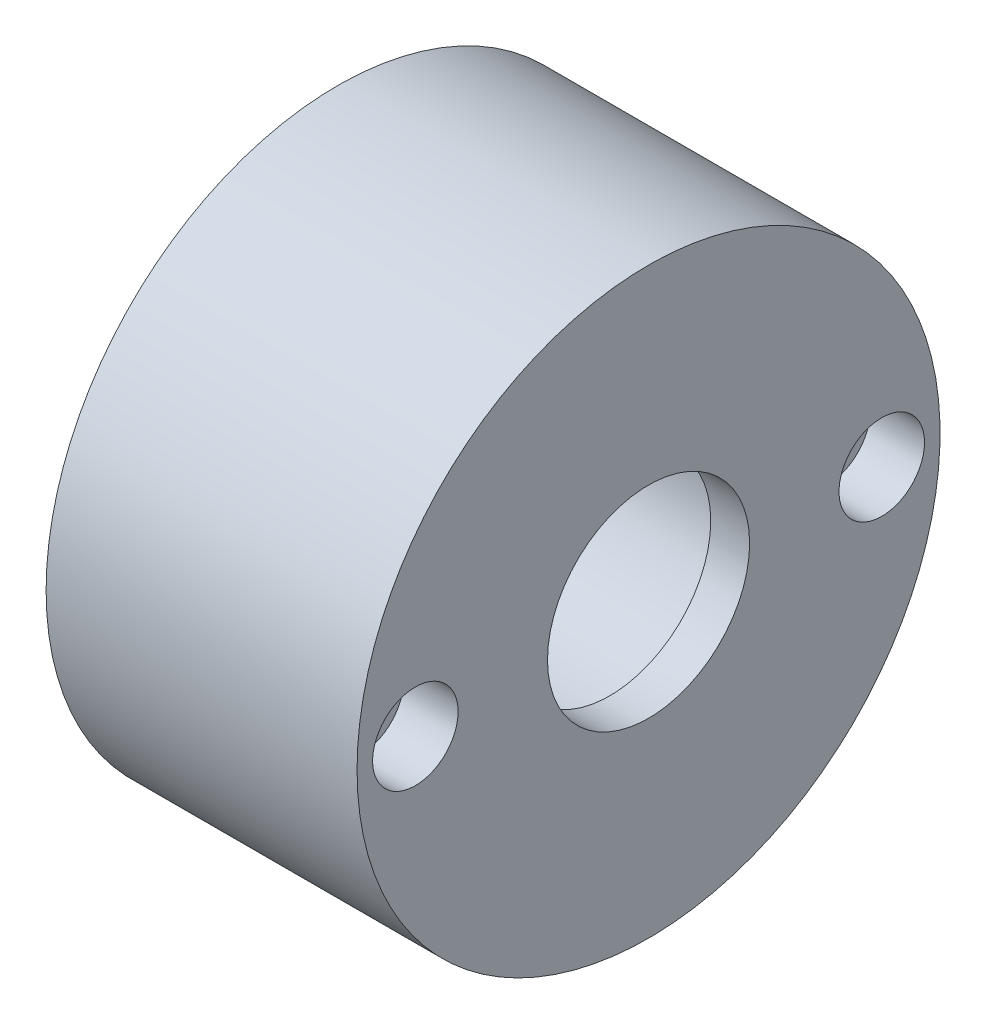
from build123d import *

# Parameters (mm, degrees)
CUT_EXTRUDE_1_DEPTH      = 67.426651278
CUT_EXTRUDE_1_DEPTH_BACK = 67.426651278
SKETCH_2_R               = 4
SKETCH_3_R               = 5.5
CUT_EXTRUDE_2_DEPTH      = 7


with BuildPart() as part:
    # ｽｹｯﾁ1 → 回転1 (revolve)
    with BuildSketch(Plane.XY, mode=Mode.PRIVATE) as revolve_1_sk:
        Polygon((-40, 16.5), (-5, 16.5), (-5, 13), (0, 13), (0, 37.5), (-40, 37.5), align=None)
    revolve(revolve_1_sk.sketch.rotate(Axis((-40, 0, 0), (1, 0, 0)), 90), axis=Axis((-40, 0, 0), (1, 0, 0)))

    # ｽｹｯﾁ2 → ｶｯﾄ - 押し出し1 (cut, two sides: drawn at the far end of the back side and taken through both)
    with BuildSketch(Plane(origin=(0, 0, 0), x_dir=(0, 0, -1), z_dir=(1, 0, 0)).offset(-CUT_EXTRUDE_1_DEPTH_BACK)):
        with Locations((30, 0)):
            Circle(SKETCH_2_R)
        with Locations((-30, 0)):
            Circle(SKETCH_2_R)
    extrude(amount=CUT_EXTRUDE_1_DEPTH + CUT_EXTRUDE_1_DEPTH_BACK, mode=Mode.SUBTRACT)

    # ｽｹｯﾁ3 → ｶｯﾄ - 押し出し2 (cut)
    with BuildSketch(Plane(origin=(0, 0, 0), x_dir=(0, 0, -1), z_dir=(1, 0, 0))):
        with Locations((30, 0)):
            Circle(SKETCH_3_R)
        with Locations((-30, 0)):
            Circle(SKETCH_3_R)
    extrude(amount=-CUT_EXTRUDE_2_DEPTH, mode=Mode.SUBTRACT)


solid = part.part
